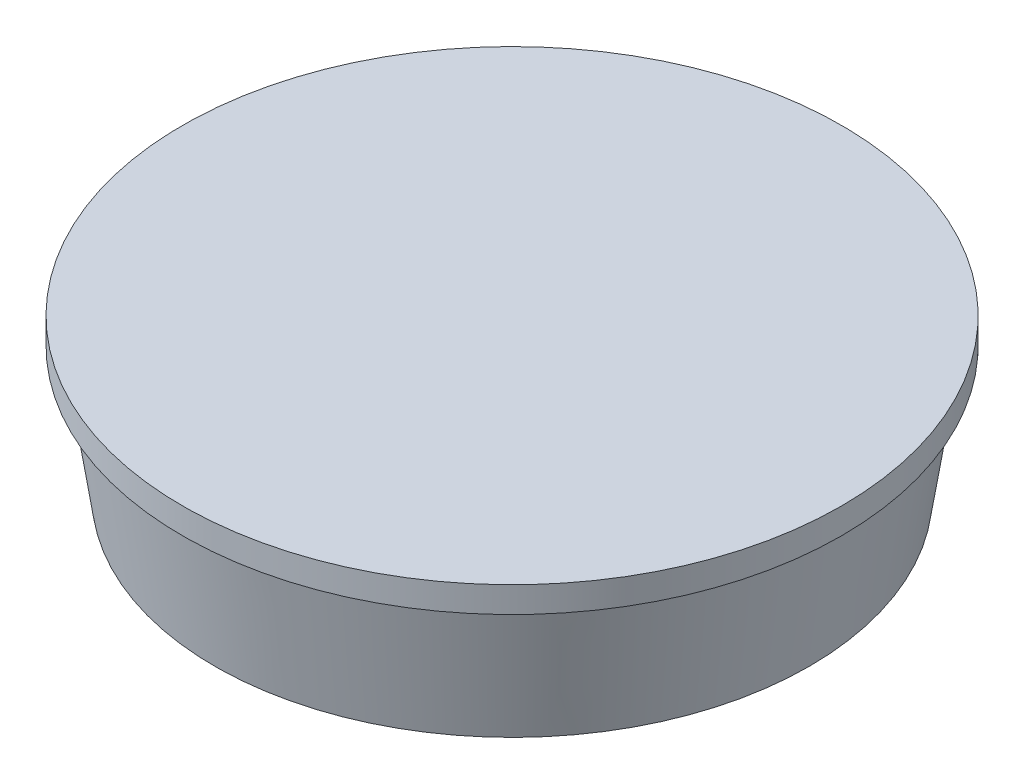
from build123d import *

# Parameters (mm, degrees)
FILLET1_R = 4


with BuildPart() as part:
    # Sketch2 → Revolve3 (revolve)
    with BuildSketch(Plane.XY):
        Polygon((22, -12), (22, -2), (0, -2), (0, 0), (25.5, 0), (25.5, -2), (24.5, -2), (23, -12), align=None)
    revolve(axis=Axis((0, -2, 0), (0, 1, 0)))

    # Fillet1
    fillet1_edges = [part.edges().sort_by_distance(p)[0] for p in [
        (-22, -2, 0),
    ]]
    fillet(fillet1_edges, radius=FILLET1_R)


solid = part.part
